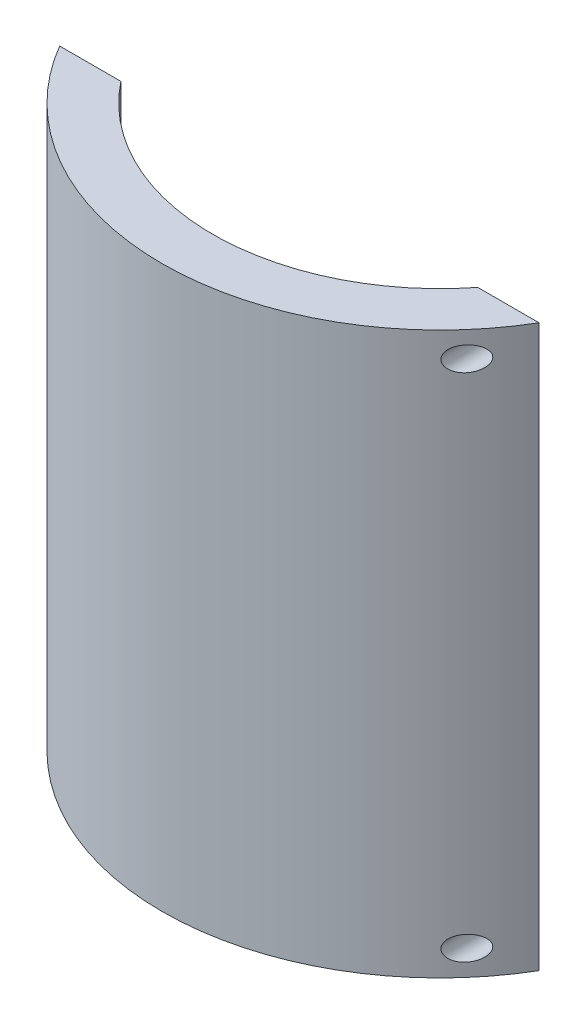
from build123d import *

# Parameters (mm, degrees)
BOSS_EXTRUDE1_DEPTH                        = 100
SKETCH2_R                                  = 2.15
CUT_EXTRUDE1_DEPTH                         = 10
MIRROR1_AT_THE_SECOND_PLANE_COPY_1_SKETC_R = 2.15
MIRROR1_AT_THE_SECOND_PLANE_COPY_1_DEPTH   = 10


with BuildPart() as part:
    # Sketch1 → Boss-Extrude1 (new body)
    with BuildSketch(Plane(origin=(0, 0, 0), x_dir=(1, 0, 0), z_dir=(0, 1, 0))):
        with BuildLine():
            ThreePointArc((31.798147977, -25.07), (0, -40.492309328), (-31.798147977, -25.07))
            Line((-31.798147977, -25.07), (-42.716694629, -25.07))
            ThreePointArc((-42.716694629, -25.07), (0, -49.53), (42.716694629, -25.07))
            Line((42.716694629, -25.07), (31.798147977, -25.07))
        make_face()
    extrude(amount=BOSS_EXTRUDE1_DEPTH)

    # Sketch2 → Cut-Extrude1 (cut)
    with BuildSketch(Plane(origin=(0, 0, 25.07), x_dir=(-1, 0, 0), z_dir=(0, 0, -1))):
        with Locations((-37.257421303, 4.5125)):
            Circle(SKETCH2_R)
    cut_extrude1 = extrude(amount=-CUT_EXTRUDE1_DEPTH, mode=Mode.SUBTRACT)

    # Mirror1: Cut-Extrude1 across plane
    add(cut_extrude1.mirror(Plane(origin=(0, 50, 0), x_dir=(0, 0, 1), z_dir=(0, -1, 0))), mode=Mode.SUBTRACT)

    # Mirror1 at the second plane: Cut-Extrude1 across plane
    add(cut_extrude1.mirror(Plane(origin=(0, 0, 0), x_dir=(0, 0, 1), z_dir=(1, 0, 0))), mode=Mode.SUBTRACT)

    # Mirror1 at the second plane copy 1 sketc → Mirror1 at the second plane copy 1 (cut)
    with BuildSketch(Plane(origin=(0, 100, 25.07), x_dir=(1, 0, 0), z_dir=(0, 0, -1))):
        with Locations((-37.257421303, 4.5125)):
            Circle(MIRROR1_AT_THE_SECOND_PLANE_COPY_1_SKETC_R)
    extrude(amount=-MIRROR1_AT_THE_SECOND_PLANE_COPY_1_DEPTH, mode=Mode.SUBTRACT)


solid = part.part
